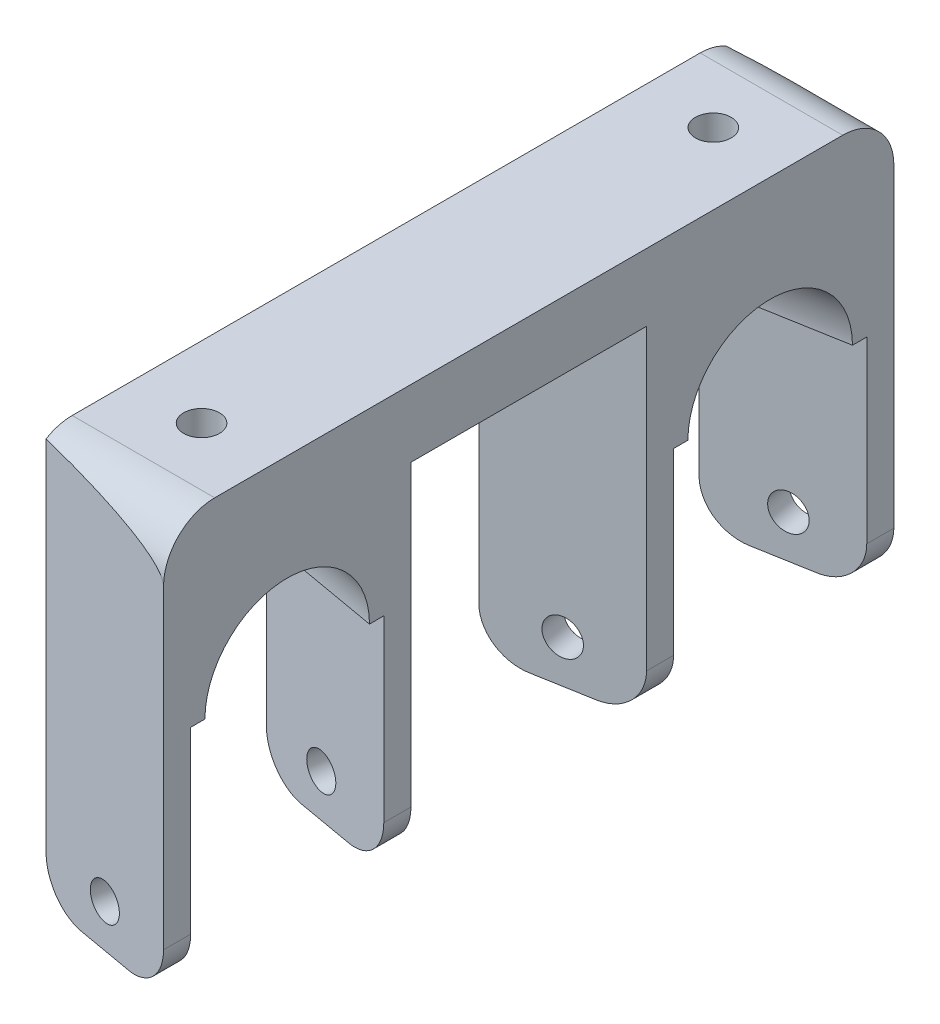
from build123d import *

# Parameters (mm, degrees)
SKETCH1_R             = 21
BOSS_EXTRUDE1_DEPTH   = 70
SKETCH2_W             = 46.708404894
SKETCH2_H             = 50
SKETCH2_W_2           = 13.291595106
CUT_EXTRUDE6_DEPTH    = 1000
CUT_EXTRUDE7_DEPTH    = 500
CUT_EXTRUDE9_DEPTH    = 10
CUT_EXTRUDE10_DEPTH   = 30
FILLET1_R             = 10
BOSS_EXTRUDE4_DEPTH   = 25
FILLET3_R             = 10
SKETCH14_R            = 4
CUT_EXTRUDE11_DEPTH   = 127.980923087
CUT_EXTRUDE12_START   = -2
CUT_EXTRUDE12_DEPTH   = 2
CUT_EXTRUDE13_DEPTH   = 2
BOSS_EXTRUDE5_REACH   = 117.988
SKETCH20_W            = 16.708404894
SKETCH20_H            = 7.898698888
SKETCH26_W            = 16.708404894
SKETCH26_H            = 7.898698888
BOSS_EXTRUDE12_DEPTH  = 7.811994
SKETCH27_W            = 16.708404894
SKETCH27_H            = 7.898698888
BOSS_EXTRUDE13_DEPTH  = 7.811994
FILLET4_R             = 6
FILLET5_R             = 6
BOSS_EXTRUDE14_DEPTH  = 40
BOSS_EXTRUDE15_DEPTH  = 40
CUT_EXTRUDE14_DEPTH   = 156.020628616
BOSS_EXTRUDE16_DEPTH  = 40
CUT_EXTRUDE16_DEPTH   = 154.401382374
CUT_EXTRUDE17_DEPTH   = 20
CUT_EXTRUDE18_DEPTH   = 20
CUT_EXTRUDE19_DEPTH   = 138.956751978
SKETCH40_W            = 185.24105406
SKETCH40_H            = 117.002542876
CUT_EXTRUDE21_DEPTH   = 127.12652477
SKETCH41_W            = 67.695511819
SKETCH41_H            = 32.478739283
CUT_EXTRUDE22_DEPTH   = 109.958332386
FILLET6_R             = 5
SKETCH78_R            = 4.1
CUT_EXTRUDE23_DEPTH   = 40.5
M5_TAPPED_HOLE2_D     = 4.2
M5_TAPPED_HOLE3_D     = 4.2
M5_TAPPED_HOLE3_DEPTH = 3.9381927
M5_TAPPED_HOLE3_TIP   = 1.2618073
M5_TAPPED_HOLE4_D     = 4.2
M5_TAPPED_HOLE4_DEPTH = 3.9381927
M5_TAPPED_HOLE4_TIP   = 1.2618073
M5_TAPPED_HOLE5_D     = 4.2
M5_TAPPED_HOLE5_DEPTH = 3.9381927
M5_TAPPED_HOLE5_TIP   = 1.2618073
M5_TAPPED_HOLE6_D     = 4.2
M5_TAPPED_HOLE6_DEPTH = 11.1381927
M5_TAPPED_HOLE6_TIP   = 1.2618073
CUT_EXTRUDE24_DEPTH   = 26
CUT_EXTRUDE25_DEPTH   = 26


with BuildPart() as part:
    # Sketch1 → Boss-Extrude1 (new body)
    with BuildSketch(Plane.XY):
        with BuildLine():
            Line((-49.790434142, -17.412639916), (50.209565858, -17.412639916))
            Line((50.209565858, -17.412639916), (50.209565858, -9.513941028))
            ThreePointArc((50.209565858, -9.513941028), (38.690061243, 42.665747249), (-10.864044799, 22.670512076))
            add(Edge.make_bspline(
                [(-49.790434142, -1.270303125), (-17.557932869, 2.386486473), (-10.864044799, 22.670512076)],
                knots=[0, 0, 0, 1, 1, 1], degree=2))
            Line((-49.790434142, -1.270303125), (-49.790434142, -17.412639916))
        make_face()
        with Locations((22.372880083, 11.702065313)):
            Circle(SKETCH1_R, mode=Mode.SUBTRACT)
    extrude(amount=BOSS_EXTRUDE1_DEPTH)

    # Sketch2 → Cut-Extrude6 (cut)
    with BuildSketch(Plane.XZ.offset(17.412639916)):
        with Locations((26.855363411, 35)):
            Rectangle(SKETCH2_W, SKETCH2_H)
        with Locations((56.855363411, 35)):
            Rectangle(SKETCH2_W_2, SKETCH2_H)
    extrude(amount=-CUT_EXTRUDE6_DEPTH, mode=Mode.SUBTRACT)

    # Sketch4 → Cut-Extrude7 (cut, symmetric)
    with BuildSketch(Plane(origin=(0, 0, 60), x_dir=(-1, 0, 0), z_dir=(0, 0, -1))):
        Polygon((-3.501160964, -17.412639916), (-33.501160964, -17.412639916), (-33.501160964, -6.106959496), (-3.501160964, 2.490213302), align=None)
    extrude(amount=CUT_EXTRUDE7_DEPTH, both=True, mode=Mode.SUBTRACT)

    # Sketch6 → Cut-Extrude9 (cut)
    with BuildSketch(Plane.XZ.offset(17.412639916)):
        with BuildLine():
            Line((-24.792277304, 11.964880704), (3.501160964, 10))
            Line((3.501160964, 10), (3.501160964, 60))
            Line((3.501160964, 60), (-24.792277304, 58.035119296))
            ThreePointArc((-24.792277304, 58.035119296), (-36.706675963, 52.357484539), (-41.545243514, 40.078368289))
            Line((-41.545243514, 40.078368289), (-41.545243514, 29.921631711))
            ThreePointArc((-41.545243514, 29.921631711), (-36.706675963, 17.642515461), (-24.792277304, 11.964880704))
        make_face()
    extrude(amount=-CUT_EXTRUDE9_DEPTH, mode=Mode.SUBTRACT)

    # Sketch7 → Cut-Extrude10 (cut)
    with BuildSketch(Plane.XZ.offset(17.412639916)):
        with BuildLine():
            Line((-49.790434142, 0), (-26.790434142, 0))
            ThreePointArc((-26.790434142, 0), (-40.575408311, 4.143958018), (-49.790434142, 15.202041029))
            Line((-49.790434142, 15.202041029), (-49.790434142, 0))
        make_face()
        with BuildLine():
            Line((-51.790434142, 0), (-49.790434142, 0))
            Line((-49.790434142, 0), (-49.790434142, 15.202041029))
            ThreePointArc((-49.790434142, 15.202041029), (-51.285331569, 20), (-51.790434142, 25))
            Line((-51.790434142, 25), (-51.790434142, 0))
        make_face()
        with BuildLine():
            ThreePointArc((-51.790434142, 45), (-51.285331569, 50), (-49.790434142, 54.797958971))
            Line((-49.790434142, 54.797958971), (-49.790434142, 70))
            Line((-49.790434142, 70), (-51.790434142, 70))
            Line((-51.790434142, 70), (-51.790434142, 45))
        make_face()
        with BuildLine():
            Line((-49.790434142, 70), (-49.790434142, 54.797958971))
            ThreePointArc((-49.790434142, 54.797958971), (-40.575408311, 65.856041982), (-26.790434142, 70))
            Line((-26.790434142, 70), (-49.790434142, 70))
        make_face()
        with BuildLine():
            ThreePointArc((-51.790434142, 25), (-51.285331569, 20), (-49.790434142, 15.202041029))
            Line((-49.790434142, 15.202041029), (-49.790434142, 54.797958971))
            ThreePointArc((-49.790434142, 54.797958971), (-51.285331569, 50), (-51.790434142, 45))
            Line((-51.790434142, 45), (-51.790434142, 25))
        make_face()
    extrude(amount=-CUT_EXTRUDE10_DEPTH, mode=Mode.SUBTRACT)

    # Fillet1
    fillet1_edges = [part.edges().sort_by_distance(p)[0] for p in [
        (-49.790434142, -1.270303125, 35),
    ]]
    fillet(fillet1_edges, radius=FILLET1_R)

    # Sketch13 → Boss-Extrude4 (add, symmetric)
    with BuildSketch(Plane(origin=(0, 0, 35), x_dir=(-1, 0, 0), z_dir=(0, 0, -1))):
        with BuildLine():
            Line((-3.501160964, 41.17846634), (-24.884209642, 72.591285845))
            Line((-24.884209642, 72.591285845), (-12.526412407, 81.003373139))
            Line((-12.526412407, 81.003373139), (8.038253711, 50.792800518))
            ThreePointArc((8.038253711, 50.792800518), (9.622093989, 48.312116906), (11.057231329, 45.742540671))
            Line((11.057231329, 45.742540671), (33.791827707, 2.064737728))
            add(Edge.make_bspline(
                [(10.864044799, 22.670512076), (15.694334208, 8.033620479), (33.791827707, 2.064737728)],
                knots=[0, 0, 0, 1, 1, 1], degree=2))
            ThreePointArc((10.864044799, 22.670512076), (5.276058191, 33.162172776), (-3.501160964, 41.17846634))
        make_face()
    extrude(amount=BOSS_EXTRUDE4_DEPTH, both=True)

    # Fillet3
    fillet3_edges = [part.edges().sort_by_distance(p)[0] for p in [
        (18.705311024, 76.797329492, 60),
        (18.705311024, 76.797329492, 10),
    ]]
    fillet(fillet3_edges, radius=FILLET3_R)

    # Sketch14 → Cut-Extrude11 (cut, through all)
    with BuildSketch(Plane(origin=(-29.120143538, 19.822399154, 0), x_dir=(0, 0, 1), z_dir=(-0.8266531448642671, 0.5627118073099384, 0))):
        with Locations(Location((35, 55.764287513, 0), (0, 0, 270))):
            Circle(SKETCH14_R)
    extrude(amount=-CUT_EXTRUDE11_DEPTH, mode=Mode.SUBTRACT)

    # Sketch16 → Cut-Extrude12 (cut)
    with BuildSketch(Plane.XY.offset(70).offset(CUT_EXTRUDE12_START)):
        with BuildLine():
            ThreePointArc((33.501160964, -7.853275764), (27.695040964, 33.563552078), (3.501160964, -0.549800564))
            Line((3.501160964, -0.549800564), (3.501160964, 2.490213302))
            ThreePointArc((3.501160964, 2.490213302), (28.158038159, 31.889485803), (33.501160964, -6.106959496))
            Line((33.501160964, -6.106959496), (33.501160964, -7.853275764))
        make_face()
    extrude(amount=CUT_EXTRUDE12_DEPTH, mode=Mode.SUBTRACT)

    # Sketch17 → Cut-Extrude13 (cut)
    with BuildSketch(Plane(origin=(0, 0, 0), x_dir=(-1, 0, 0), z_dir=(0, 0, -1))):
        with BuildLine():
            ThreePointArc((-3.501160964, -0.549800564), (-27.695040964, 33.563552078), (-33.501160964, -7.853275764))
            Line((-33.501160964, -7.853275764), (-33.501160964, -6.106959496))
            ThreePointArc((-33.501160964, -6.106959496), (-28.158038159, 31.889485803), (-3.501160964, 2.490213302))
            Line((-3.501160964, 2.490213302), (-3.501160964, -0.549800564))
        make_face()
    extrude(amount=-CUT_EXTRUDE13_DEPTH, mode=Mode.SUBTRACT)

    # Sketch20 → Boss-Extrude5 (add, up to next)
    with BuildSketch(Plane.XY.offset(10), mode=Mode.PRIVATE) as boss_extrude5_sk1:
        with Locations((41.855363411, -13.463290472)):
            Rectangle(SKETCH20_W, SKETCH20_H)
    boss_extrude5_tool1 = extrude(boss_extrude5_sk1.sketch, amount=BOSS_EXTRUDE5_REACH, mode=Mode.PRIVATE) - part.part
    add(boss_extrude5_tool1.solids().sort_by_distance((41.855363, -13.46329, 10))[0])

    # Sketch26 → Boss-Extrude12 (add)
    with BuildSketch(Plane(origin=(0, 0, 0), x_dir=(-1, 0, 0), z_dir=(0, 0, -1))):
        with Locations((-41.855363411, -13.463290472)):
            Rectangle(SKETCH26_W, SKETCH26_H)
    extrude(amount=BOSS_EXTRUDE12_DEPTH)

    # Sketch27 → Boss-Extrude13 (add)
    with BuildSketch(Plane.XY.offset(70)):
        with Locations((41.855363411, -13.463290472)):
            Rectangle(SKETCH27_W, SKETCH27_H)
    extrude(amount=BOSS_EXTRUDE13_DEPTH)

    # Fillet4
    fillet4_edges = [part.edges().sort_by_distance(p)[0] for p in [
        (41.855363411, -9.513941028, -7.811994),
    ]]
    fillet(fillet4_edges, radius=FILLET4_R)

    # Fillet5
    fillet5_edges = [part.edges().sort_by_distance(p)[0] for p in [
        (41.855363411, -9.513941028, 77.811994),
    ]]
    fillet(fillet5_edges, radius=FILLET5_R)

    # Sketch22 → Boss-Extrude14 (add)
    with BuildSketch(Plane.XZ.offset(17.412639916)):
        Polygon((50.209565858, 48.811993748), (50.209565858, 77.811993748), (33.501160964, 74.865851161), (33.501160964, 45.865851161), align=None)
        Polygon((50.209565858, 21.188006252), (33.501160964, 24.134148839), (33.501160964, -4.865851161), (50.209565858, -7.811993748), align=None)
    extrude(amount=BOSS_EXTRUDE14_DEPTH)

    # Sketch31 → Boss-Extrude15 (add)
    with BuildSketch(Plane.XZ.offset(57.412639916)):
        Polygon((50.209565858, 21.188006252), (55.168857937, 20.313549253), (50.209565858, -7.811993748), align=None)
    extrude(amount=-BOSS_EXTRUDE15_DEPTH)

    # Sketch33 → Cut-Extrude14 (cut, through all)
    with BuildSketch(Plane(origin=(50.031491805, 0, -8.82190189), x_dir=(-0.17364817766693016, 0, -0.9848077530122082), z_dir=(0.9848077530122082, 0, -0.17364817766693016))):
        with BuildLine():
            Line((-5.805200022, -31.412639916), (-5.805200022, -57.412639916))
            Line((-5.805200022, -57.412639916), (-24.805200022, -57.412639916))
            Line((-24.805200022, -57.412639916), (-24.805200022, -31.412639916))
            ThreePointArc((-24.805200022, -31.412639916), (-15.305200022, -21.912639916), (-5.805200022, -31.412639916))
        make_face()
    extrude(amount=-CUT_EXTRUDE14_DEPTH, mode=Mode.SUBTRACT)

    # Sketch34 → Boss-Extrude16 (add)
    with BuildSketch(Plane.XZ.offset(57.412639916)):
        Polygon((50.209565858, 48.811993748), (55.168857937, 49.686450747), (50.209565858, 77.811993748), align=None)
    extrude(amount=-BOSS_EXTRUDE16_DEPTH)

    # Sketch36 → Cut-Extrude16 (cut, through all)
    with BuildSketch(Plane(origin=(62.002196821, 0, 10.932660163), x_dir=(0.1736481776669346, 0, -0.9848077530122074), z_dir=(0.9848077530122075, 0, 0.17364817766693463))):
        with BuildLine():
            Line((-44.131342689, -31.412639916), (-44.131342689, -57.412639916))
            Line((-44.131342689, -57.412639916), (-63.131342689, -57.412639916))
            Line((-63.131342689, -57.412639916), (-63.131342689, -31.412639916))
            ThreePointArc((-63.131342689, -31.412639916), (-53.631342689, -21.912639916), (-44.131342689, -31.412639916))
        make_face()
    extrude(amount=-CUT_EXTRUDE16_DEPTH, mode=Mode.SUBTRACT)

    # Sketch37 → Cut-Extrude17 (cut)
    with BuildSketch(Plane.XZ.offset(17.412639916)):
        Polygon((33.501160964, -4.865851161), (33.501160964, -7.811993748), (50.209565858, -7.811993748), align=None)
    extrude(amount=-CUT_EXTRUDE17_DEPTH, mode=Mode.SUBTRACT)

    # Sketch38 → Cut-Extrude18 (cut)
    with BuildSketch(Plane.XZ.offset(17.412639916)):
        Polygon((50.209565858, 77.811993748), (33.501160964, 77.811993748), (33.501160964, 74.865851161), align=None)
    extrude(amount=-CUT_EXTRUDE18_DEPTH, mode=Mode.SUBTRACT)

    # Sketch39 → Cut-Extrude19 (cut, through all)
    with BuildSketch(Plane(origin=(0, -17.412639916, 0), x_dir=(1, 0, 0), z_dir=(0, 1, 0))):
        Polygon((50.209565858, -48.811993748), (55.168857937, -49.686450747), (50.209565858, -77.811993748), align=None)
        Polygon((50.209565858, 7.811993748), (55.168857937, -20.313549253), (50.209565858, -21.188006252), align=None)
    extrude(amount=-CUT_EXTRUDE19_DEPTH, mode=Mode.SUBTRACT)

    # Sketch40 → Cut-Extrude21 (cut, through all)
    with BuildSketch(Plane.XY):
        with Locations((-9.514852979, 48.98733041)):
            Rectangle(SKETCH40_W, SKETCH40_H)
    extrude(amount=CUT_EXTRUDE21_DEPTH, mode=Mode.SUBTRACT)


with BuildPart() as cut_extrude21_piece_1:
    # of the separate pieces the step leaves, piece 1, a body of its own (cut_extrude21_pieces)
    add(part.part.solids().sort_by_distance((33.501160964, -57.412639916, 74.865851161))[0])

    # Fillet6
    fillet6_edges = [cut_extrude21_piece_1.edges().sort_by_distance(p)[0] for p in [
        (33.501160964, -57.412639916, 72.439127567),
        (33.501160964, -57.412639916, -2.439127567),
        (33.501160964, -57.412639916, 21.707425246),
        (33.501160964, -57.412639916, 48.292574754),
        (50.209565858, -57.412639916, 51.238717342),
        (50.209565858, -57.412639916, 75.385270155),
        (50.209565858, -57.412639916, -5.385270155),
        (50.209565858, -57.412639916, 18.761282658),
    ]]
    fillet(fillet6_edges, radius=FILLET6_R)

    # Sketch78 → Cut-Extrude23 (cut)
    with BuildSketch(Plane.XZ.offset(57.412639916)):
        with Locations((41.855363411, 5)):
            Circle(SKETCH78_R)
        with Locations((41.855363411, 65)):
            Circle(SKETCH78_R)
    extrude(amount=-CUT_EXTRUDE23_DEPTH, mode=Mode.SUBTRACT)

    # M5 Tapped Hole2 (through all)
    with Locations(Plane(origin=(41.855363411, -16.912639916, 65), x_dir=(-1, 0, 0), z_dir=(0, -1, 0))):
        with Locations((0, 0), (0, 60)):
            Hole(M5_TAPPED_HOLE2_D / 2)

    # M5 Tapped Hole3
    with Locations(Plane(origin=(41.855363411, -52.412639916, -6.338922455), x_dir=(-0.984807753012, 0, 0.173648177667), z_dir=(-0.173648177667, 0, -0.984807753012))):
        with Locations((0, 0)):
            Hole(M5_TAPPED_HOLE3_D / 2, depth=M5_TAPPED_HOLE3_DEPTH)
            with Locations((0, 0, -(M5_TAPPED_HOLE3_DEPTH + M5_TAPPED_HOLE3_TIP / 2))):  # 118° drill point
                Cone(0, M5_TAPPED_HOLE3_D / 2, M5_TAPPED_HOLE3_TIP, mode=Mode.SUBTRACT)

    # M5 Tapped Hole4
    with Locations(Plane(origin=(41.855363411, -52.412639916, 76.338922455), x_dir=(0.984807753012, 0, 0.173648177667), z_dir=(-0.173648177667, 0, 0.984807753012))):
        with Locations((0, 0)):
            Hole(M5_TAPPED_HOLE4_D / 2, depth=M5_TAPPED_HOLE4_DEPTH)
            with Locations((0, 0, -(M5_TAPPED_HOLE4_DEPTH + M5_TAPPED_HOLE4_TIP / 2))):  # 118° drill point
                Cone(0, M5_TAPPED_HOLE4_D / 2, M5_TAPPED_HOLE4_TIP, mode=Mode.SUBTRACT)

    # M5 Tapped Hole5
    with Locations(Plane(origin=(41.855363411, -52.412639916, 22.661077545), x_dir=(0.984807753012, 0, -0.173648177667), z_dir=(0.173648177667, 0, 0.984807753012))):
        with Locations((0, 0)):
            Hole(M5_TAPPED_HOLE5_D / 2, depth=M5_TAPPED_HOLE5_DEPTH)
            with Locations((0, 0, -(M5_TAPPED_HOLE5_DEPTH + M5_TAPPED_HOLE5_TIP / 2))):  # 118° drill point
                Cone(0, M5_TAPPED_HOLE5_D / 2, M5_TAPPED_HOLE5_TIP, mode=Mode.SUBTRACT)

    # M5 Tapped Hole6
    with Locations(Plane(origin=(41.855363411, -52.412639916, 47.338922455), x_dir=(-0.984807753012, 0, -0.173648177667), z_dir=(0.173648177667, 0, -0.984807753012))):
        with Locations((0, 0)):
            Hole(M5_TAPPED_HOLE6_D / 2, depth=M5_TAPPED_HOLE6_DEPTH)
            with Locations((0, 0, -(M5_TAPPED_HOLE6_DEPTH + M5_TAPPED_HOLE6_TIP / 2))):  # 118° drill point
                Cone(0, M5_TAPPED_HOLE6_D / 2, M5_TAPPED_HOLE6_TIP, mode=Mode.SUBTRACT)

    # Sketch88 → Cut-Extrude24 (cut)
    with BuildSketch(Plane.XZ.offset(57.412639916)):
        Polygon((33.501160964, -1.688351161), (50.209565858, -4.634493748), (50.209565858, 18.010506252), (33.501160964, 20.956648839), align=None)
    extrude(amount=-CUT_EXTRUDE24_DEPTH, mode=Mode.SUBTRACT)

    # Sketch93 → Cut-Extrude25 (cut)
    with BuildSketch(Plane.XZ.offset(57.412639916)):
        Polygon((33.501160964, 49.043351161), (50.209565858, 51.989493748), (50.209565858, 74.634493748), (33.501160964, 71.688351161), align=None)
    extrude(amount=-CUT_EXTRUDE25_DEPTH, mode=Mode.SUBTRACT)


with BuildPart() as cut_extrude21_piece_2:
    # of the separate pieces the step leaves, piece 2, a body of its own (cut_extrude21_pieces)
    add(part.part.solids().sort_by_distance((3.501160964, -17.412639916, 0))[0])

    # Sketch41 → Cut-Extrude22 (cut, through all)
    with BuildSketch(Plane.XY):
        with Locations((-18.815044507, -13.828974806)):
            Rectangle(SKETCH41_W, SKETCH41_H)
    extrude(amount=CUT_EXTRUDE22_DEPTH, mode=Mode.SUBTRACT)


solid = cut_extrude21_piece_1.part
